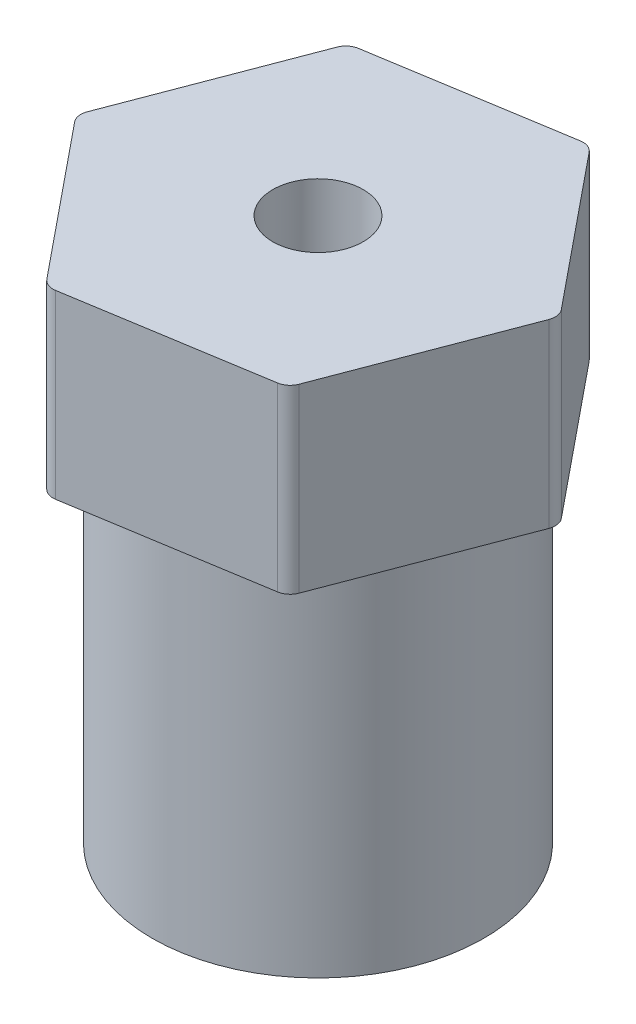
from build123d import *

# Parameters (mm, degrees)
SKETCH1_R                    = 5.5
BOSS_EXTRUDE1_DEPTH          = 12
BOSS_EXTRUDE2_DEPTH          = 6
M5_CLEARANCE_HOLE1_D         = 5.5
M5_CLEARANCE_HOLE1_DEPTH     = 12
M5_CLEARANCE_HOLE1_TIP       = 1.652366702
F_3_0_3_DIAMETER_HOLE1_D     = 3
F_3_0_3_DIAMETER_HOLE1_DEPTH = 6
F_3_0_3_DIAMETER_HOLE1_TIP   = 0.901290929
FILLET1_R                    = 0.5


with BuildPart() as part:
    # Sketch1 → Boss-Extrude1 (new body)
    with BuildSketch(Plane(origin=(0, 0, 0), x_dir=(1, 0, 0), z_dir=(0, 1, 0))):
        with Locations(Location((0, 0, 0), (0, 0, 270))):
            Circle(SKETCH1_R)
    extrude(amount=BOSS_EXTRUDE1_DEPTH)

    # Sketch2 → Boss-Extrude2 (add)
    with BuildSketch(Plane(origin=(0, 12, 0), x_dir=(1, 0, 0), z_dir=(0, 1, 0))):
        Polygon((4.42120467, -5.427057146), (6.910571691, 1.115346986), (2.489367021, 6.542404132), (-4.42120467, 5.427057146), (-6.910571691, -1.115346986), (-2.489367021, -6.542404132), align=None)
    extrude(amount=BOSS_EXTRUDE2_DEPTH)

    # M5 Clearance Hole1
    with Locations(Plane.XZ):
        with Locations((0, 0)):
            Hole(M5_CLEARANCE_HOLE1_D / 2, depth=M5_CLEARANCE_HOLE1_DEPTH)
            with Locations((0, 0, -(M5_CLEARANCE_HOLE1_DEPTH + M5_CLEARANCE_HOLE1_TIP / 2))):  # 118° drill point
                Cone(0, M5_CLEARANCE_HOLE1_D / 2, M5_CLEARANCE_HOLE1_TIP, mode=Mode.SUBTRACT)

    # Ø3.0 (3) Diameter Hole1
    with Locations(Plane(origin=(0, 18, 0), x_dir=(1, 0, 0), z_dir=(0, 1, 0))):
        with Locations((0, 0)):
            Hole(F_3_0_3_DIAMETER_HOLE1_D / 2, depth=F_3_0_3_DIAMETER_HOLE1_DEPTH)
            with Locations((0, 0, -(F_3_0_3_DIAMETER_HOLE1_DEPTH + F_3_0_3_DIAMETER_HOLE1_TIP / 2))):  # 118° drill point
                Cone(0, F_3_0_3_DIAMETER_HOLE1_D / 2, F_3_0_3_DIAMETER_HOLE1_TIP, mode=Mode.SUBTRACT)

    # Fillet1
    fillet1_edges = [part.edges().sort_by_distance(p)[0] for p in [
        (-2.489367021, 15, 6.542404132),
        (4.42120467, 15, 5.427057146),
        (6.910571691, 15, -1.115346986),
        (2.489367021, 15, -6.542404132),
        (-4.42120467, 15, -5.427057146),
        (-6.910571691, 15, 1.115346986),
    ]]
    fillet(fillet1_edges, radius=FILLET1_R)


solid = part.part
